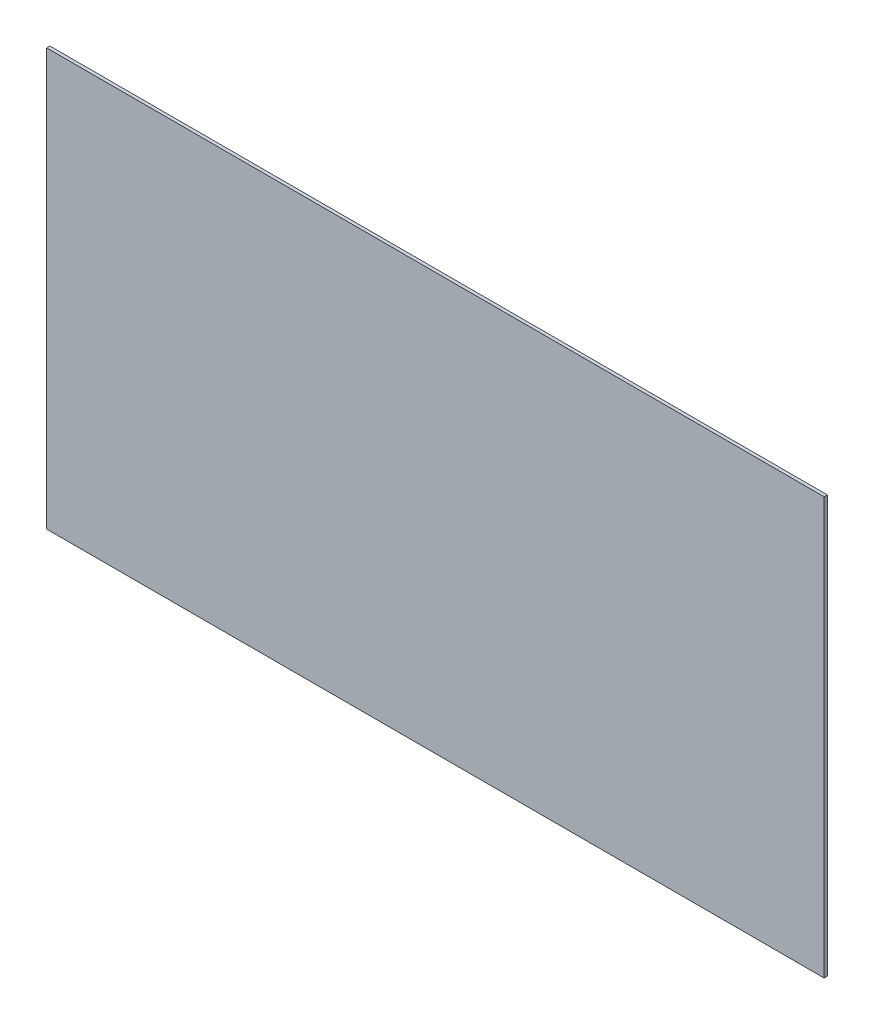
from build123d import *

# Parameters (mm, degrees)
SKIZZE1_W                       = 485
SKIZZE1_H                       = 260
AUFSATZ_LINEAR_AUSTRAGEN1_DEPTH = 2


with BuildPart() as part:
    # Skizze1 → Aufsatz-Linear austragen1 (new body)
    with BuildSketch(Plane.XY):
        with Locations((242.5, 130)):
            Rectangle(SKIZZE1_W, SKIZZE1_H)
    extrude(amount=AUFSATZ_LINEAR_AUSTRAGEN1_DEPTH)


solid = part.part
